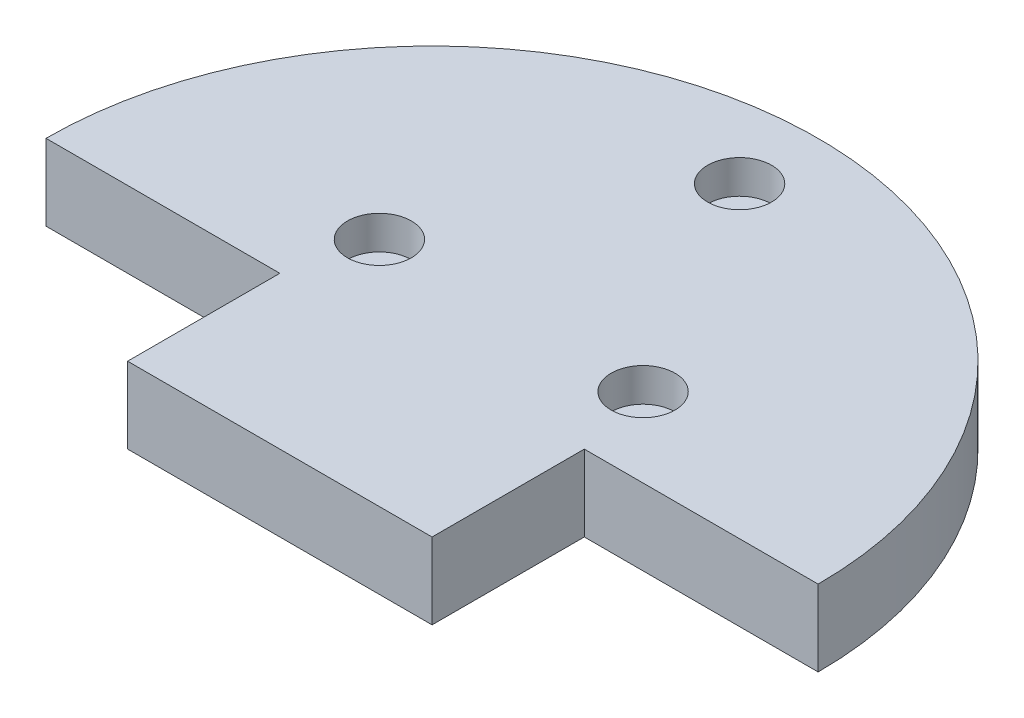
from build123d import *

# Parameters (mm, degrees)
SALIENTE_EXTRUIR1_DEPTH = 5
CROQUIS2_R              = 2.1
CORTAR_EXTRUIR1_DEPTH   = 2.2
CROQUIS3_R              = 1
CORTAR_EXTRUIR2_DEPTH   = 10


with BuildPart() as part:
    # Croquis1 → Saliente-Extruir1 (new body)
    with BuildSketch(Plane(origin=(0, 0, 0), x_dir=(1, 0, 0), z_dir=(0, 1, 0))):
        with BuildLine():
            Line((-10, 0), (10, 0))
            Line((10, 0), (10, 10))
            Line((10, 10), (25.36, 10))
            ThreePointArc((25.36, 10), (0, 35.36), (-25.36, 10))
            Line((-25.36, 10), (-10, 10))
            Line((-10, 10), (-10, 0))
        make_face()
    extrude(amount=SALIENTE_EXTRUIR1_DEPTH)

    # Croquis2 → Cortar-Extruir1 (cut)
    with BuildSketch(Plane(origin=(0, 5, 0), x_dir=(1, 0, 0), z_dir=(0, 1, 0))):
        with Locations(Location((0, 30.2, 0), (0, 0, 270))):
            Circle(CROQUIS2_R)
        with Locations(Location((8.66, 15.2, 0), (0, 0, 270))):
            Circle(CROQUIS2_R)
        with Locations(Location((-8.66, 15.2, 0), (0, 0, 270))):
            Circle(CROQUIS2_R)
    extrude(amount=-CORTAR_EXTRUIR1_DEPTH, mode=Mode.SUBTRACT)

    # Croquis3 → Cortar-Extruir2 (cut)
    with BuildSketch(Plane(origin=(0, 5, 0), x_dir=(1, 0, 0), z_dir=(0, 1, 0))):
        with Locations(Location((-8.66, 15.2, 0), (0, 0, 270))):
            Circle(CROQUIS3_R)
        with Locations(Location((8.66, 15.2, 0), (0, 0, 270))):
            Circle(CROQUIS3_R)
        with Locations(Location((0, 30.2, 0), (0, 0, 270))):
            Circle(CROQUIS3_R)
    extrude(amount=-CORTAR_EXTRUIR2_DEPTH, mode=Mode.SUBTRACT)


solid = part.part
